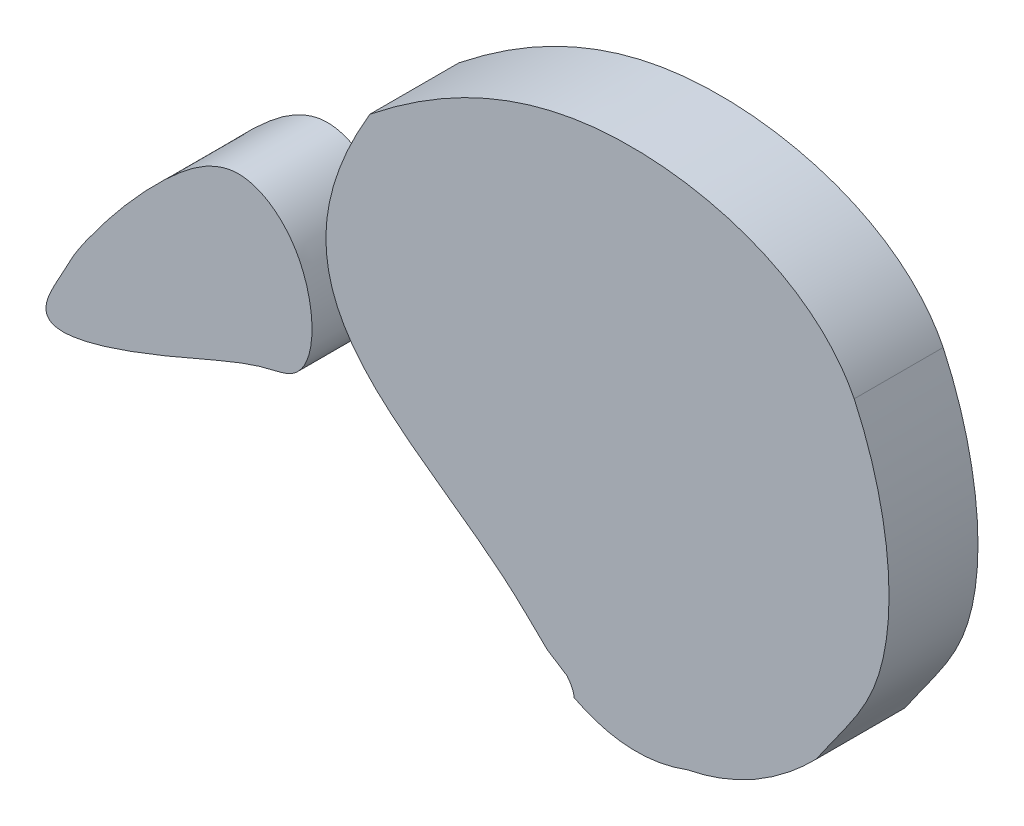
from build123d import *

# Parameters (mm, degrees)
BOSS_EXTRUDE1_DEPTH   = 9.8
BOSS_EXTRUDE1_2_DEPTH = 9.8


with BuildPart() as part:
    # Sketch1 → Boss-Extrude1 (new body)
    with BuildSketch(Plane.XY):
        with BuildLine():
            add(Edge.make_bspline(
                [(24.504132241, 13.759980156), (24.964447854, 13.224605023), (25.217486421, 12.650642003), (25.297576464, 12.053795843)],
                knots=[0.123396326, 0.123396326, 0.123396326, 0.123396326, 0.218579713, 0.218579713, 0.218579713, 0.218579713], degree=3))
            add(Edge.make_bspline(
                [(37.821139836, 11.427740345), (31.298382762, 8.974298335), (25.297576464, 12.053795843)],
                knots=[0, 0, 0, 1, 1, 1], degree=2))
            add(Edge.make_bspline(
                [(37.821139836, 11.427740345), (45.485413132, 12.957784456), (51.946056973, 19.514695727)],
                knots=[0.435157314, 0.435157314, 0.435157314, 1, 1, 1], degree=2))
            add(Edge.make_bspline(
                [(56.146272285, 56.002622278), (59.988455308, 47.838832857), (62.111941981, 32.048927989), (54.325811088, 23.043128297), (51.946056973, 19.514695727)],
                knots=[0.327008298, 0.327008298, 0.327008298, 0.327008298, 0.684334569, 0.840119751, 0.840119751, 0.840119751, 0.840119751], degree=3))
            add(Edge.make_bspline(
                [(2.781570235, 56.477875573), (9.755051735, 62.019508327), (27.108309867, 71.830202469), (51.627140953, 65.121771613), (56.146272285, 56.002622278)],
                knots=[0, 0, 0, 0, 0.462605328, 0.983650205, 0.983650205, 0.983650205, 0.983650205], degree=3))
            add(Edge.make_bspline(
                [(2.781570235, 56.477875573), (-10.918170192, 33.352271784), (9.373748922, 28.441294286), (21.275896824, 16.136341738), (22.329588328, 15.1510014)],
                knots=[0, 0, 0, 0, 0.747546219, 0.818239289, 0.818239289, 0.818239289, 0.818239289], degree=3))
            add(Edge.make_bspline(
                [(22.329588328, 15.1510014), (23.051954496, 14.710500516), (23.776807683, 14.247063274), (24.504132241, 13.759980156)],
                knots=[0.962116035, 0.962116035, 0.962116035, 0.962116035, 0.97724346, 0.97724346, 0.97724346, 0.97724346], degree=3))
        make_face()
    extrude(amount=BOSS_EXTRUDE1_DEPTH)


with BuildPart() as body_2:
    # Sketch1 → Boss-Extrude1 2 (new body)
    with BuildSketch(Plane.XY):
        with BuildLine():
            add(Edge.make_bspline(
                [(-28.390242352, 28.897309014), (-26.571388659, 31.463209098), (-20.953212453, 38.716241813), (-11.890538346, 45.286711747), (-3.100169417, 39.269363724), (-2.789275481, 27.42936163), (-9.740256623, 26.532045009), (-38.710808991, 13.420352633), (-31.550867998, 22.687481493), (-30.056508931, 26.546667194), (-28.390242352, 28.897309014)],
                knots=[0, 0, 0, 0, 0.120347822, 0.195890844, 0.256651725, 0.359848028, 0.390374163, 0.443364198, 0.889748387, 1, 1, 1, 1], degree=3))
        make_face()
    extrude(amount=BOSS_EXTRUDE1_2_DEPTH)


solid = Compound([part.part, body_2.part])
